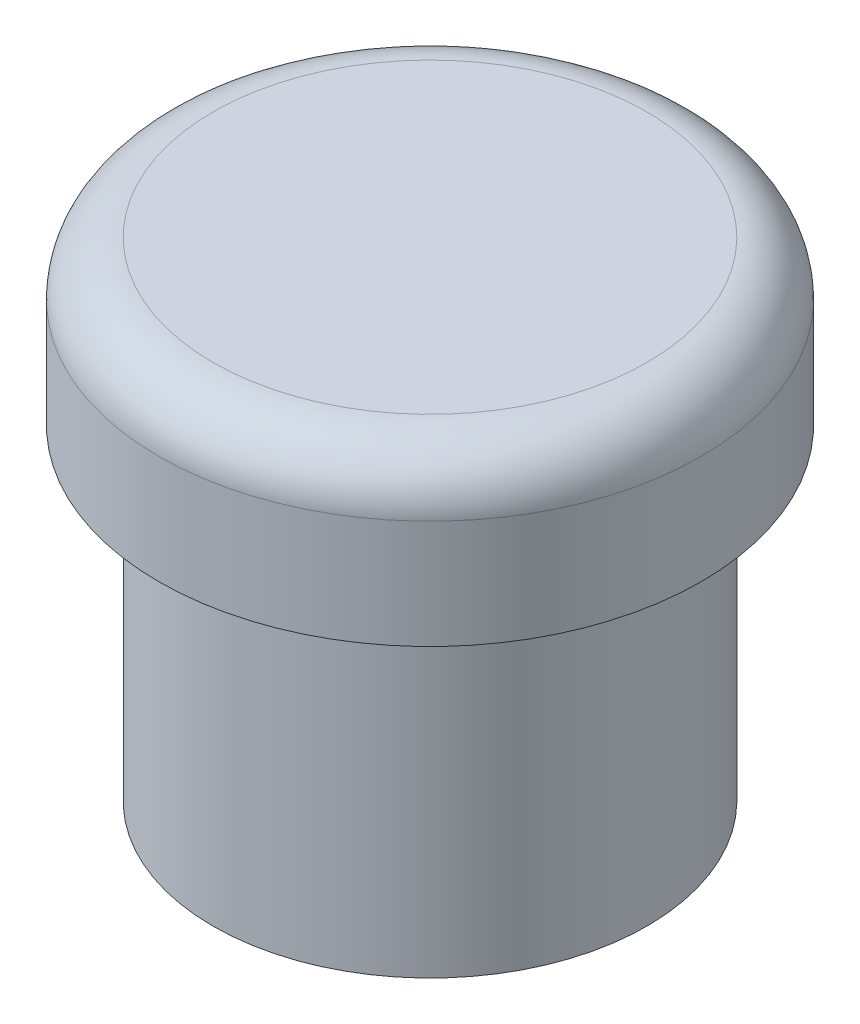
from build123d import *

# Parameters (mm, degrees)
SKETCH1_R           = 2
SKETCH1_R_2         = 1.5875
BOSS_EXTRUDE1_DEPTH = 3
SKETCH2_R           = 2.5
BOSS_EXTRUDE2_DEPTH = 1.5
FILLET1_R           = 0.5


with BuildPart() as part:
    # Sketch1 → Boss-Extrude1 (new body)
    with BuildSketch(Plane(origin=(0, 0, 0), x_dir=(1, 0, 0), z_dir=(0, 1, 0))):
        with Locations(Location((0, 0, 0), (0, 0, 270))):
            Circle(SKETCH1_R)
        with Locations(Location((0, 0, 0), (0, 0, 270))):
            Circle(SKETCH1_R_2, mode=Mode.SUBTRACT)
    extrude(amount=BOSS_EXTRUDE1_DEPTH)

    # Sketch2 → Boss-Extrude2 (add)
    with BuildSketch(Plane(origin=(0, 3, 0), x_dir=(1, 0, 0), z_dir=(0, 1, 0))):
        with Locations(Location((0, 0, 0), (0, 0, 270))):
            Circle(SKETCH2_R)
    extrude(amount=BOSS_EXTRUDE2_DEPTH)

    # Fillet1
    fillet1_edges = [part.edges().sort_by_distance(p)[0] for p in [
        (0, 4.5, -2.5),
    ]]
    fillet(fillet1_edges, radius=FILLET1_R)


solid = part.part
